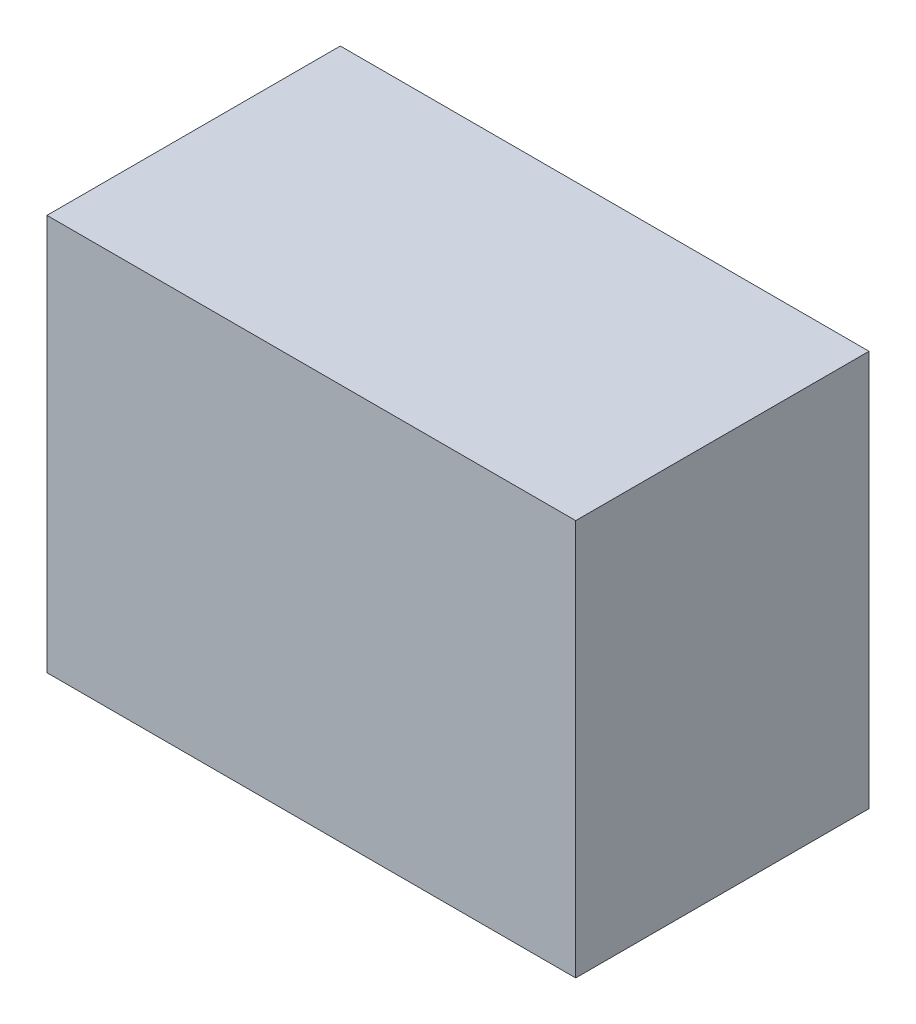
from build123d import *

# Parameters (mm, degrees)
SKETCH1_W           = 68.497044295
SKETCH1_H           = 51.317721288
BOSS_EXTRUDE1_DEPTH = 38


with BuildPart() as part:
    # Sketch1 → Boss-Extrude1 (new body)
    with BuildSketch(Plane.XY):
        with Locations((-2.532848905, 4.404954617)):
            Rectangle(SKETCH1_W, SKETCH1_H)
    extrude(amount=BOSS_EXTRUDE1_DEPTH)


solid = part.part
